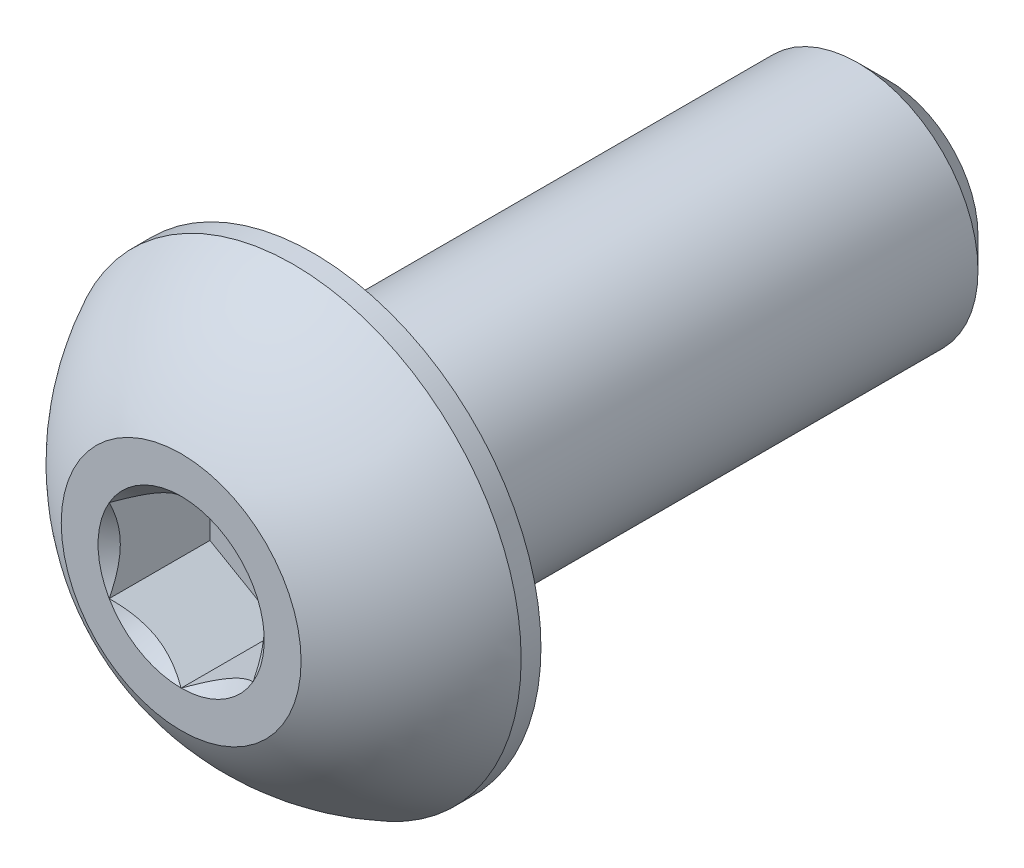
from build123d import *

# Parameters (mm, degrees)
CUT_EXTRUDE1_DEPTH = 2.1


with BuildPart() as part:
    # Sketch2 → Revolve1 (revolve)
    with BuildSketch(Plane(origin=(0, 0, 0), x_dir=(0, 0, -1), z_dir=(1, 0, 0)), mode=Mode.PRIVATE) as revolve1_sk:
        with BuildLine():
            Line((-7.375, 0), (7.375, 0))
            Line((7.375, 0), (7.375, 1.86))
            Line((7.375, 1.86), (6.735, 2.5))
            Line((6.735, 2.5), (-4.625, 2.5))
            Line((-4.625, 2.5), (-4.625, 4.75))
            Line((-4.625, 4.75), (-5.0375, 4.75))
            ThreePointArc((-5.0375, 4.75), (-6.383124817, 3.808753282), (-7.375, 2.5))
            Line((-7.375, 2.5), (-7.375, 0))
        make_face()
    revolve(revolve1_sk.sketch.rotate(Axis((0, 0, 7.375), (0, 0, -1)), 90), axis=Axis((0, 0, 7.375), (0, 0, -1)))

    # Sketch3 → Cut-Extrude1 (cut)
    with BuildSketch(Plane.XY.offset(7.375)):
        Polygon((0, 1.732050808), (-1.5, 0.866025404), (-1.5, -0.866025404), (0, -1.732050808), (1.5, -0.866025404), (1.5, 0.866025404), align=None)
    extrude(amount=-CUT_EXTRUDE1_DEPTH, mode=Mode.SUBTRACT)

    # Cut-Extrude2 cone 1 section (through the dimple's axis) → Cut-Extrude2 (revolve, cut)
    with BuildSketch(Plane(origin=(0, 0, 7.375), x_dir=(0, -1, 0), z_dir=(1, 0, 0))):
        Polygon((0, 0), (1.732050808, 0), (0, 1.732050808), align=None)
    revolve(axis=Axis((0, 0, 7.375), (0, 0, -1)), mode=Mode.SUBTRACT)


solid = part.part
